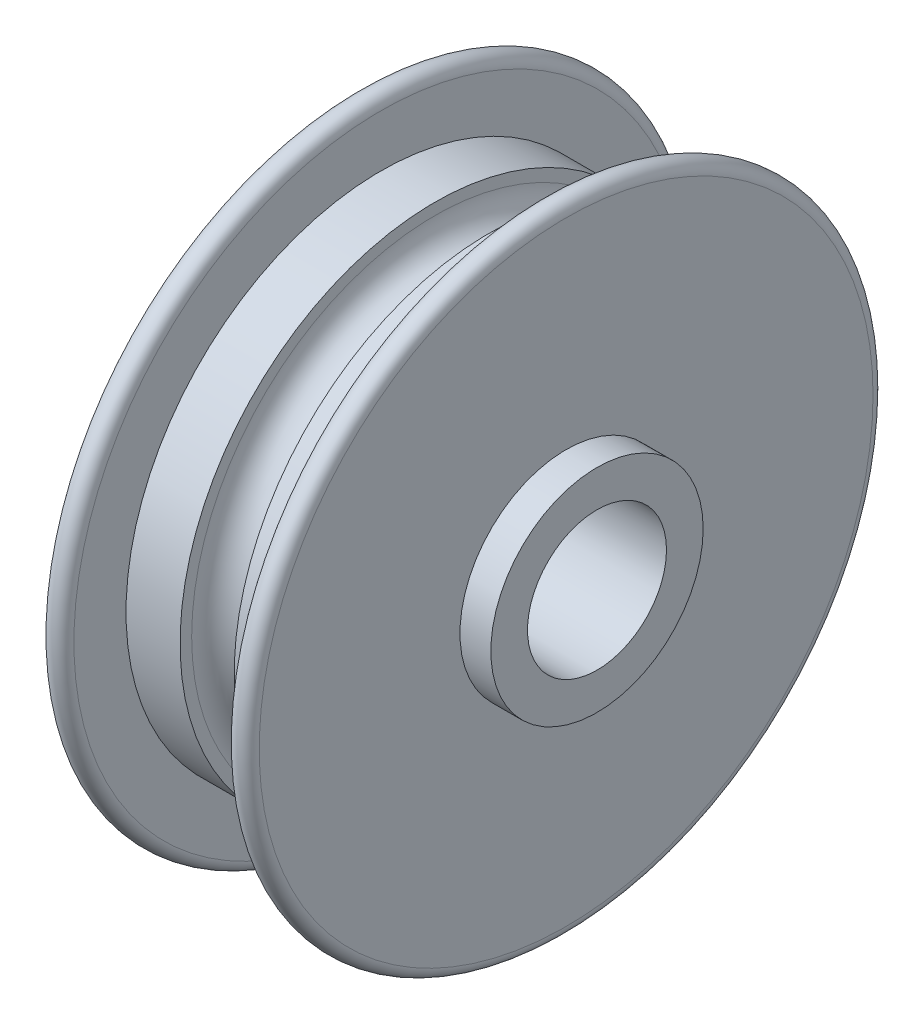
from build123d import *


with BuildPart() as part:
    # Sketch1 → Revolve1 (revolve)
    with BuildSketch(Plane.XY, mode=Mode.PRIVATE) as revolve1_sk:
        with BuildLine():
            Line((-8.824086632, 9), (8.675913368, 9))
            Line((8.675913368, 9), (8.675913368, 28))
            ThreePointArc((8.675913368, 28), (6.201039634, 29.025126266), (5.175913368, 31.5))
            Line((5.175913368, 31.5), (5.175913368, 33))
            Line((5.175913368, 33), (-1.824086632, 33))
            Line((-1.824086632, 33), (-1.824086632, 39.75))
            ThreePointArc((-1.824086632, 39.75), (-3.324086632, 41.25), (-4.824086632, 39.75))
            Line((-4.824086632, 39.75), (-4.824086632, 13.75))
            Line((-4.824086632, 13.75), (-8.824086632, 13.75))
            Line((-8.824086632, 13.75), (-8.824086632, 9))
        make_face()
        with BuildLine():
            Line((26.175913368, 9), (26.175913368, 13.75))
            Line((26.175913368, 13.75), (22.175913368, 13.75))
            Line((22.175913368, 13.75), (22.175913368, 39.75))
            ThreePointArc((22.175913368, 39.75), (20.675913368, 41.25), (19.175913368, 39.75))
            Line((19.175913368, 39.75), (19.175913368, 33))
            Line((19.175913368, 33), (12.175913368, 33))
            Line((12.175913368, 33), (12.175913368, 31.5))
            ThreePointArc((12.175913368, 31.5), (11.150787102, 29.025126266), (8.675913368, 28))
            Line((8.675913368, 28), (8.675913368, 9))
            Line((8.675913368, 9), (26.175913368, 9))
        make_face()
    revolve(revolve1_sk.sketch.rotate(Axis((-24.461552005, 0, 0), (1, 0, 0)), 270), axis=Axis((-24.461552005, 0, 0), (1, 0, 0)))


solid = part.part
